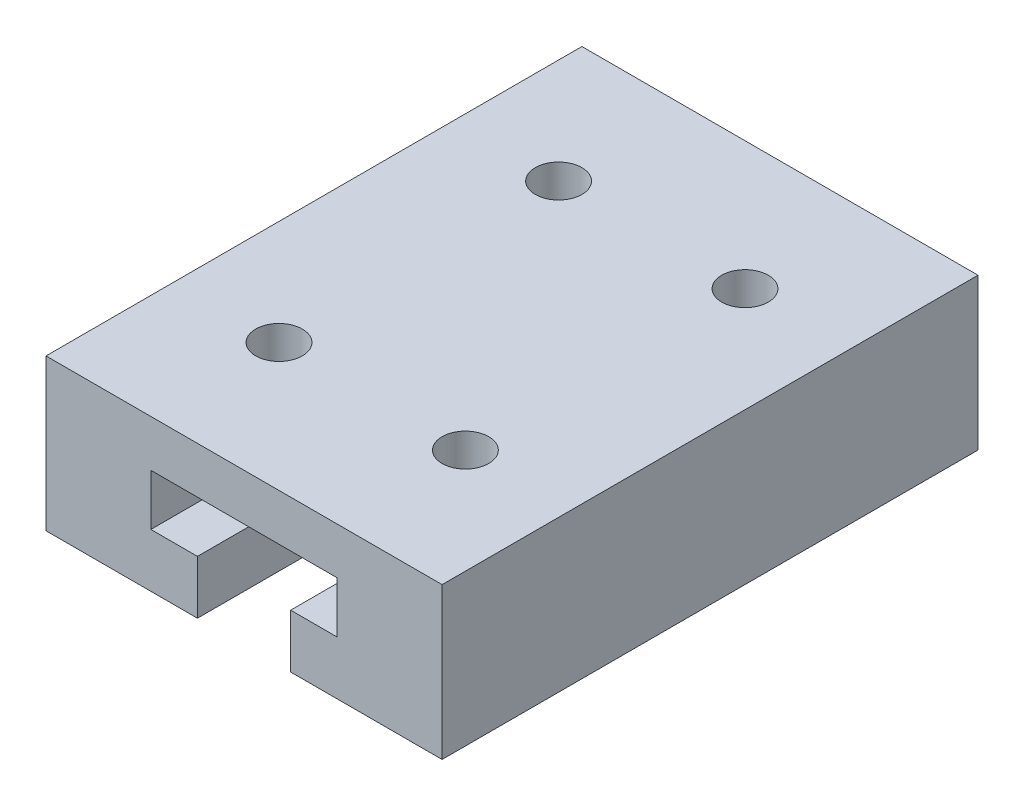
from build123d import *

# Parameters (mm, degrees)
DODANIE_WYCI_GNI_CIE1_DEPTH = 23
SZKIC2_R                    = 1
WYTNIJ_WYCI_GNI_CIE1_DEPTH  = 1.5


with BuildPart() as part:
    # Szkic1 → Dodanie-wyciągnięcie1 (new body)
    with BuildSketch(Plane.XY):
        Polygon((0, 0), (0, 2), (-8.5, 2), (-8.5, -4.5), (-2, -4.5), (-2, -2.2), (-4, -2.2), (-4, 0), align=None)
    dodanie_wyci_gni_cie1 = extrude(amount=DODANIE_WYCI_GNI_CIE1_DEPTH)

    # Lustro1: Dodanie-wyciągnięcie1 across plane
    add(dodanie_wyci_gni_cie1.mirror(Plane(origin=(0, 0, 23), x_dir=(0, 0, 1), z_dir=(-1, 0, 0))))

    # Szkic2 → Wytnij-wyciągnięcie1 (cut)
    with BuildSketch(Plane(origin=(0, 2, 0), x_dir=(1, 0, 0), z_dir=(0, 1, 0))):
        with Locations(Location((-4, -5.5, 0), (0, 0, 180))):
            Circle(SZKIC2_R)
        with Locations(Location((4, -5.5, 0), (0, 0, 180))):
            Circle(SZKIC2_R)
        with Locations(Location((4, -17.5, 0), (0, 0, 180))):
            Circle(SZKIC2_R)
        with Locations(Location((-4, -17.5, 0), (0, 0, 180))):
            Circle(SZKIC2_R)
    extrude(amount=-WYTNIJ_WYCI_GNI_CIE1_DEPTH, mode=Mode.SUBTRACT)


solid = part.part
